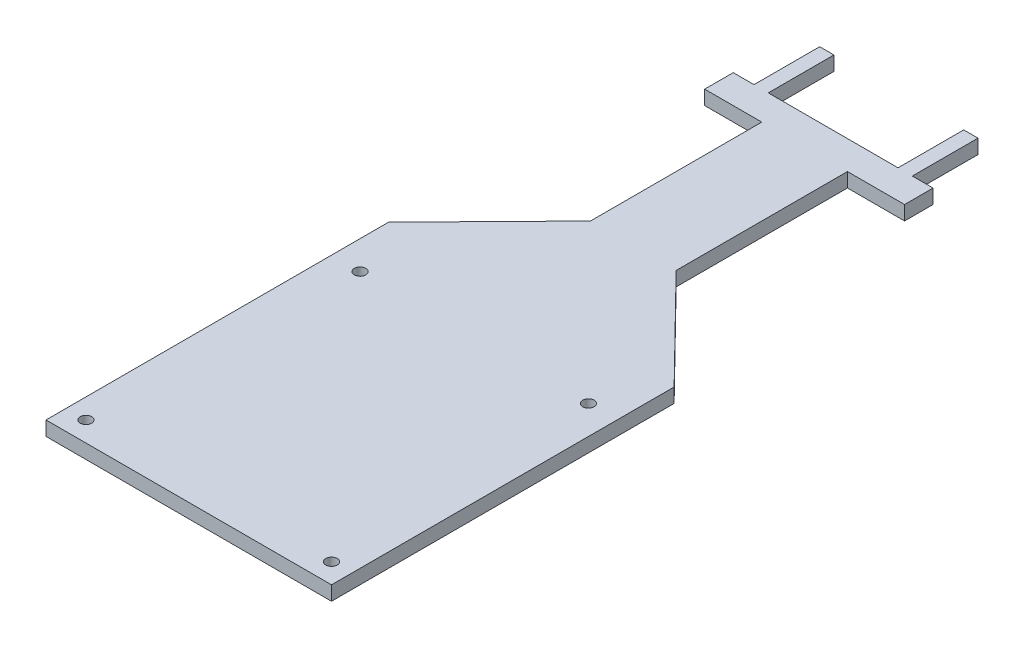
from build123d import *

# Parameters (mm, degrees)
SKETCH1_R           = 2
BOSS_EXTRUDE1_DEPTH = 5


with BuildPart() as part:
    # Sketch1 → Boss-Extrude1 (new body)
    with BuildSketch(Plane(origin=(0, 0, 0), x_dir=(1, 0, 0), z_dir=(0, 1, 0))):
        Polygon((-50, 60), (-50, -60), (50, -60), (50, 60), (15, 95.707142143), (15, 155.707142143), (35, 155.707142143), (35, 165.707142143), (27.728991778, 165.707142143), (27.728991778, 188.707142143), (22.728991778, 188.707142143), (22.728991778, 165.707142143), (-22.728991778, 165.707142143), (-22.728991778, 188.707142143), (-27.728991778, 188.707142143), (-27.728991778, 165.707142143), (-35, 165.707142143), (-35, 155.707142143), (-15, 155.707142143), (-15, 95.707142143), align=None)
        with Locations(Location((40, 40, 0), (0, 0, 270))):
            Circle(SKETCH1_R, mode=Mode.SUBTRACT)
        with Locations(Location((-40, 40, 0), (0, 0, 270))):
            Circle(SKETCH1_R, mode=Mode.SUBTRACT)
        with Locations(Location((-43, -53, 0), (0, 0, 270))):
            Circle(SKETCH1_R, mode=Mode.SUBTRACT)
        with Locations(Location((43, -53, 0), (0, 0, 270))):
            Circle(SKETCH1_R, mode=Mode.SUBTRACT)
    extrude(amount=BOSS_EXTRUDE1_DEPTH)


solid = part.part
